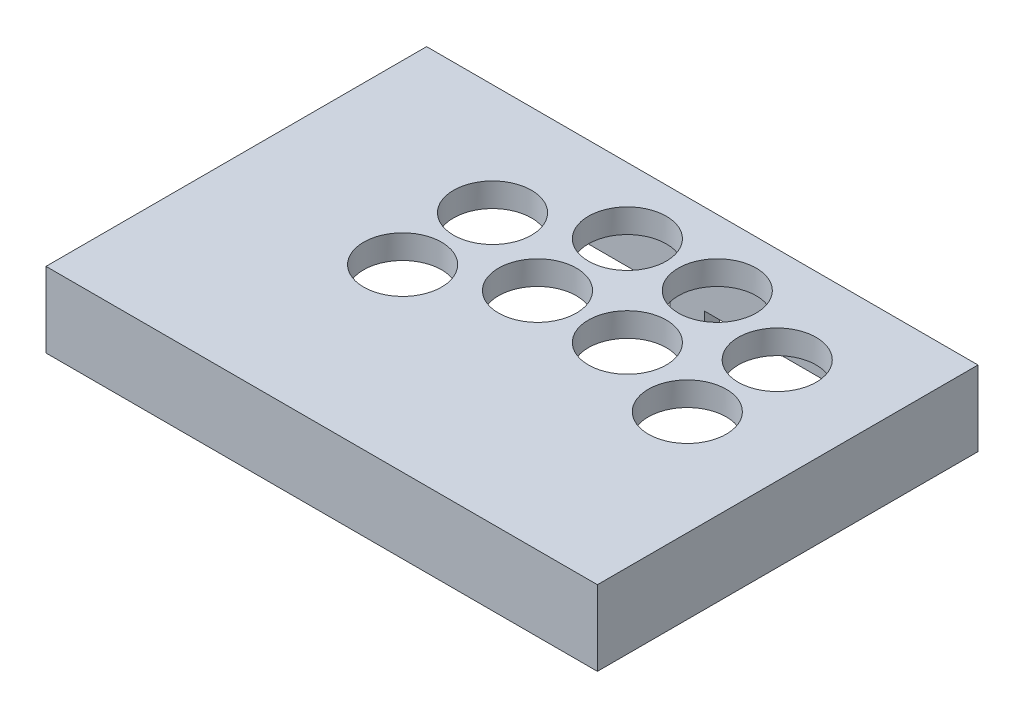
from build123d import *

# Parameters (mm, degrees)
SKETCH1_W           = 254
SKETCH1_H           = 127
BOSS_EXTRUDE2_DEPTH = 19.05
SKETCH2_W           = 244
SKETCH2_H           = 117
CUT_EXTRUDE1_DEPTH  = 17.05
SKETCH4_R           = 13
CUT_EXTRUDE2_DEPTH  = 17.05
SKETCH5_W           = 70
SKETCH5_H           = 127
CUT_EXTRUDE3_DEPTH  = 45
SKETCH6_W           = 5
SKETCH6_H           = 117
BOSS_EXTRUDE3_DEPTH = 17.05
BOSS_EXTRUDE4_START = 6
SKETCH7_W           = 184
SKETCH7_H           = 127
SKETCH7_R           = 13
BOSS_EXTRUDE4_DEPTH = 6
BOSS_EXTRUDE5_DEPTH = 17.05
SKETCH9_W           = 11.462803728
SKETCH9_H           = 5
BOSS_EXTRUDE6_DEPTH = 10
SKETCH10_R          = 1.5
CUT_EXTRUDE4_DEPTH  = 23
SKETCH11_W          = 5
SKETCH11_H          = 15
CUT_EXTRUDE6_DEPTH  = 1.5
SKETCH13_W          = 6.3
SKETCH13_H          = 6.3
CUT_EXTRUDE8_DEPTH  = 4.5
SKETCH16_R          = 1
CUT_EXTRUDE10_DEPTH = 5.5
SKETCH17_R          = 1.71
CUT_EXTRUDE11_DEPTH = 10


with BuildPart() as part:
    # Sketch1 → Boss-Extrude2 (new body)
    with BuildSketch(Plane(origin=(0, 0, 0), x_dir=(1, 0, 0), z_dir=(0, 1, 0))):
        Rectangle(SKETCH1_W, SKETCH1_H)
    extrude(amount=BOSS_EXTRUDE2_DEPTH)

    # Sketch2 → Cut-Extrude1 (cut)
    with BuildSketch(Plane.XZ):
        Rectangle(SKETCH2_W, SKETCH2_H)
    extrude(amount=-CUT_EXTRUDE1_DEPTH, mode=Mode.SUBTRACT)

    # Sketch4 → Cut-Extrude2 (cut)
    with BuildSketch(Plane(origin=(0, 19.05, 0), x_dir=(1, 0, 0), z_dir=(0, 1, 0))):
        with Locations(Location((92, 1.5, 0), (0, 0, 270))):
            Circle(SKETCH4_R)
        with Locations(Location((92, 31.5, 0), (0, 0, 270))):
            Circle(SKETCH4_R)
        with Locations(Location((62, 11.5, 0), (0, 0, 270))):
            Circle(SKETCH4_R)
        with Locations(Location((62, 41.5, 0), (0, 0, 270))):
            Circle(SKETCH4_R)
        with Locations(Location((32, 11.5, 0), (0, 0, 270))):
            Circle(SKETCH4_R)
        with Locations(Location((32, 41.5, 0), (0, 0, 270))):
            Circle(SKETCH4_R)
        with Locations(Location((2, -3.5, 0), (0, 0, 270))):
            Circle(SKETCH4_R)
        with Locations(Location((2, 26.5, 0), (0, 0, 270))):
            Circle(SKETCH4_R)
    extrude(amount=-CUT_EXTRUDE2_DEPTH, mode=Mode.SUBTRACT)

    # Sketch5 → Cut-Extrude3 (cut)
    with BuildSketch(Plane.XZ):
        with Locations((-92, 0)):
            Rectangle(SKETCH5_W, SKETCH5_H)
    extrude(amount=-CUT_EXTRUDE3_DEPTH, mode=Mode.SUBTRACT)

    # Sketch6 → Boss-Extrude3 (add)
    with BuildSketch(Plane.XZ.offset(-17.05)):
        with Locations((-54.5, 0)):
            Rectangle(SKETCH6_W, SKETCH6_H)
    extrude(amount=BOSS_EXTRUDE3_DEPTH)

    # Sketch7 → Boss-Extrude4 (add)
    with BuildSketch(Plane(origin=(0, 19.05, 0), x_dir=(1, 0, 0), z_dir=(0, 1, 0)).offset(BOSS_EXTRUDE4_START)):
        with Locations((35, 0)):
            Rectangle(SKETCH7_W, SKETCH7_H)
        with Locations(Location((2, 26.5, 0), (0, 0, 270))):
            Circle(SKETCH7_R, mode=Mode.SUBTRACT)
        with Locations(Location((2, -3.5, 0), (0, 0, 270))):
            Circle(SKETCH7_R, mode=Mode.SUBTRACT)
        with Locations(Location((32, 11.5, 0), (0, 0, 270))):
            Circle(SKETCH7_R, mode=Mode.SUBTRACT)
        with Locations(Location((92, 31.5, 0), (0, 0, 270))):
            Circle(SKETCH7_R, mode=Mode.SUBTRACT)
        with Locations(Location((62, 11.5, 0), (0, 0, 270))):
            Circle(SKETCH7_R, mode=Mode.SUBTRACT)
        with Locations(Location((62, 41.5, 0), (0, 0, 270))):
            Circle(SKETCH7_R, mode=Mode.SUBTRACT)
        with Locations(Location((32, 41.5, 0), (0, 0, 270))):
            Circle(SKETCH7_R, mode=Mode.SUBTRACT)
        with Locations(Location((92, 1.5, 0), (0, 0, 270))):
            Circle(SKETCH7_R, mode=Mode.SUBTRACT)
    extrude(amount=-BOSS_EXTRUDE4_DEPTH)

    # Sketch8 → Boss-Extrude5 (add)
    with BuildSketch(Plane.XZ.offset(-17.05)):
        with BuildLine():
            Line((118.5, 58.5), (122, 58.5))
            Line((122, 58.5), (122, 55))
            ThreePointArc((122, 55), (119.525126266, 56.025126266), (118.5, 58.5))
        make_face()
        with BuildLine():
            Line((122, -55), (122, -58.5))
            Line((122, -58.5), (118.5, -58.5))
            ThreePointArc((118.5, -58.5), (119.525126266, -56.025126266), (122, -55))
        make_face()
        with BuildLine():
            Line((-52, -55), (-52, -58.5))
            Line((-52, -58.5), (-48.5, -58.5))
            ThreePointArc((-48.5, -58.5), (-49.525126266, -56.025126266), (-52, -55))
        make_face()
        with BuildLine():
            Line((-52, 55), (-52, 58.5))
            Line((-52, 58.5), (-48.5, 58.5))
            ThreePointArc((-48.5, 58.5), (-49.525126266, 56.025126266), (-52, 55))
        make_face()
    extrude(amount=BOSS_EXTRUDE5_DEPTH)

    # Sketch9 → Boss-Extrude6 (add)
    with BuildSketch(Plane.XZ):
        with Locations((35, -61)):
            Rectangle(SKETCH9_W, SKETCH9_H)
    extrude(amount=BOSS_EXTRUDE6_DEPTH)

    # Sketch10 → Cut-Extrude4 (cut)
    with BuildSketch(Plane.XZ):
        with Locations(Location((122, -58.5, 0), (0, 0, 270))):
            Circle(SKETCH10_R)
        with Locations(Location((122, 58.5, 0), (0, 0, 270))):
            Circle(SKETCH10_R)
        with Locations(Location((-52, -58.5, 0), (0, 0, 270))):
            Circle(SKETCH10_R)
        with Locations(Location((-52, 58.5, 0), (0, 0, 270))):
            Circle(SKETCH10_R)
    extrude(amount=-CUT_EXTRUDE4_DEPTH, mode=Mode.SUBTRACT)

    # Sketch11 → Cut-Extrude6 (cut)
    with BuildSketch(Plane.XZ):
        with Locations((-54.5, -26)):
            Rectangle(SKETCH11_W, SKETCH11_H)
    extrude(amount=-CUT_EXTRUDE6_DEPTH, mode=Mode.SUBTRACT)

    # Sketch13 → Cut-Extrude8 (cut)
    with BuildSketch(Plane.XY.offset(-58.5)):
        with Locations((-30.184481008, 4.938954373)):
            Rectangle(SKETCH13_W, SKETCH13_H)
        with Locations((-40.184481008, 4.938954373)):
            Rectangle(SKETCH13_W, SKETCH13_H)
        with Locations((-20.184481008, 4.938954373)):
            Rectangle(SKETCH13_W, SKETCH13_H)
    extrude(amount=-CUT_EXTRUDE8_DEPTH, mode=Mode.SUBTRACT)

    # Sketch16 → Cut-Extrude10 (cut)
    with BuildSketch(Plane.XZ.offset(-17.05)):
        with Locations(Location((111.144556631, 25.062533315, 0), (0, 0, 270))):
            Circle(SKETCH16_R)
        with Locations(Location((111.144556631, -53.90768708, 0), (0, 0, 270))):
            Circle(SKETCH16_R)
        with Locations(Location((-23.950730393, -53.90768708, 0), (0, 0, 270))):
            Circle(SKETCH16_R)
        with Locations(Location((-23.950730393, 25.062533315, 0), (0, 0, 270))):
            Circle(SKETCH16_R)
    extrude(amount=-CUT_EXTRUDE10_DEPTH, mode=Mode.SUBTRACT)

    # Sketch17 → Cut-Extrude11 (cut)
    with BuildSketch(Plane.XY.offset(-63)):
        with Locations((-40.184481008, 4.938954373)):
            Circle(SKETCH17_R)
        with Locations((-30.184481008, 4.938954373)):
            Circle(SKETCH17_R)
        with Locations((-20.184481008, 4.938954373)):
            Circle(SKETCH17_R)
    extrude(amount=-CUT_EXTRUDE11_DEPTH, mode=Mode.SUBTRACT)


solid = part.part
